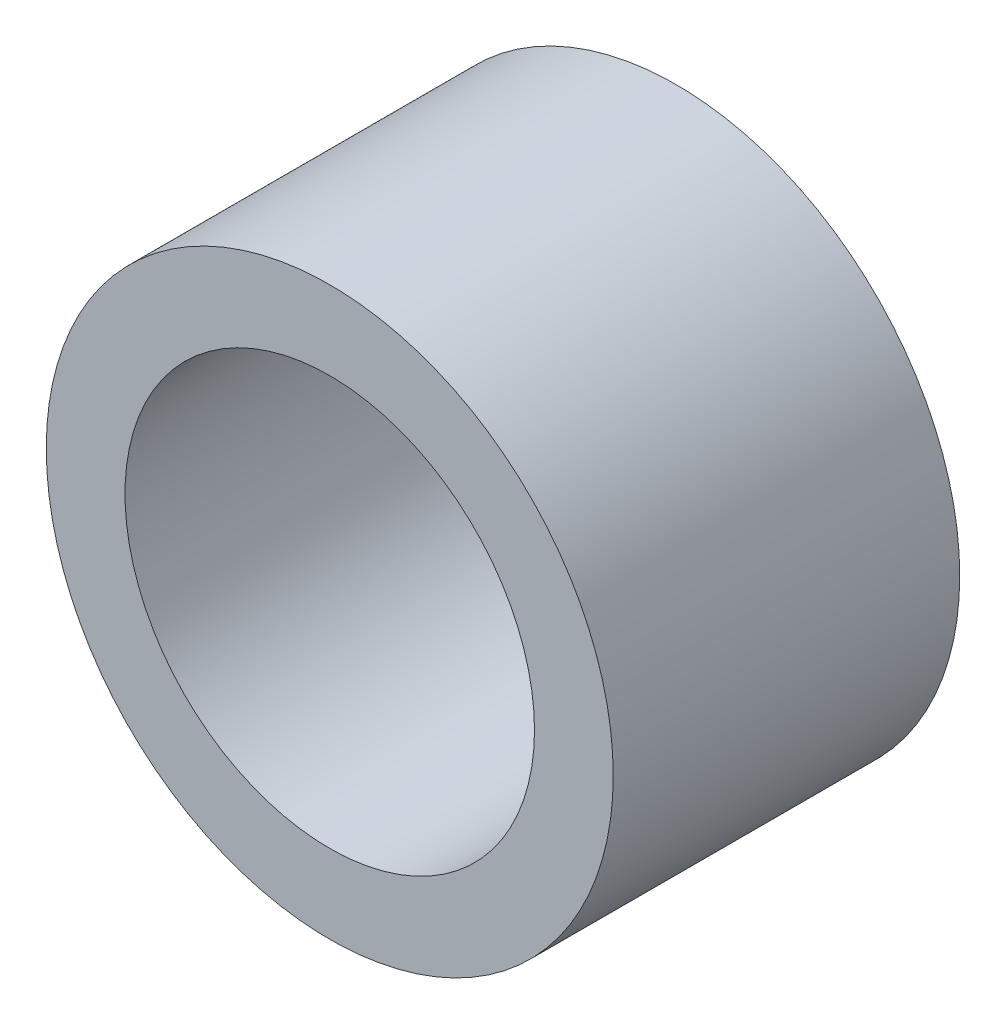
from build123d import *

# Parameters (mm, degrees)
SKETCH_1_R      = 4.5
SKETCH_1_R_2    = 3.25
EXTRUDE_1_DEPTH = 5.5


with BuildPart() as part:
    # ｽｹｯﾁ1 → ﾎﾞｽ - 押し出し1 (new body)
    with BuildSketch(Plane.XY):
        Circle(SKETCH_1_R)
        Circle(SKETCH_1_R_2, mode=Mode.SUBTRACT)
    extrude(amount=EXTRUDE_1_DEPTH)


solid = part.part
